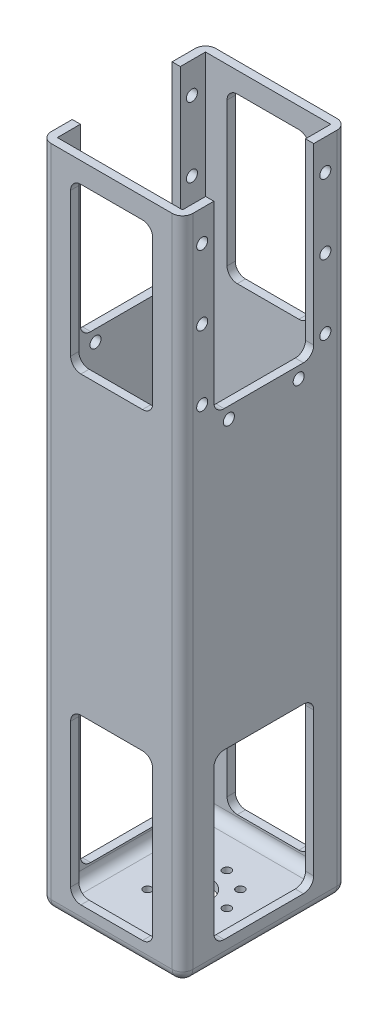
from build123d import *

# Parameters (mm, degrees)
SKETCH2_W           = 34.5
SKETCH2_H           = 40.1
BOSS_EXTRUDE1_DEPTH = 2
SKETCH1_R           = 1
SKETCH1_R_2         = 4.25
CUT_EXTRUDE2_DEPTH  = 27.524799716
SKETCH3_W           = 34.5
SKETCH3_H           = 40.1
SKETCH3_W_2         = 30.5
SKETCH3_H_2         = 36.1
BOSS_EXTRUDE3_DEPTH = 160
SKETCH4_W           = 24.336491673
SKETCH4_H           = 45
SKETCH4_H_2         = 40
CUT_EXTRUDE3_DEPTH  = 167.841998609
SKETCH5_W           = 20
SKETCH5_H           = 40
CUT_EXTRUDE4_DEPTH  = 168.778343358
FILLET1_R           = 2.5
SKETCH7_R           = 1.350000001
CUT_EXTRUDE5_DEPTH  = 167.841998609


with BuildPart() as part:
    # Sketch2 → Boss-Extrude1 (new body)
    with BuildSketch(Plane(origin=(0, 0, 0), x_dir=(1, 0, 0), z_dir=(0, 1, 0))):
        Rectangle(SKETCH2_W, SKETCH2_H)
    extrude(amount=BOSS_EXTRUDE1_DEPTH)

    # Sketch1 → Cut-Extrude2 (cut, through all)
    with BuildSketch(Plane(origin=(0, 0, 0), x_dir=(1, 0, 0), z_dir=(0, 1, 0))):
        with Locations(Location((0, 8, 0), (0, 0, 270))):
            Circle(SKETCH1_R)
        with Locations(Location((5.656854249, 5.656854249, 0), (0, 0, 270))):
            Circle(SKETCH1_R)
        with Locations(Location((8, 0, 0), (0, 0, 270))):
            Circle(SKETCH1_R)
        with Locations(Location((5.656854249, -5.656854249, 0), (0, 0, 270))):
            Circle(SKETCH1_R)
        with Locations(Location((0, -8, 0), (0, 0, 270))):
            Circle(SKETCH1_R)
        with Locations(Location((-5.656854249, -5.656854249, 0), (0, 0, 270))):
            Circle(SKETCH1_R)
        with Locations(Location((-8, 0, 0), (0, 0, 270))):
            Circle(SKETCH1_R)
        with Locations(Location((-5.656854249, 5.656854249, 0), (0, 0, 270))):
            Circle(SKETCH1_R)
        with Locations(Location((0, 0, 0), (0, 0, 270))):
            Circle(SKETCH1_R_2)
    extrude(amount=CUT_EXTRUDE2_DEPTH, mode=Mode.SUBTRACT)

    # Sketch3 → Boss-Extrude3 (add)
    with BuildSketch(Plane(origin=(0, 2, 0), x_dir=(1, 0, 0), z_dir=(0, 1, 0))):
        Rectangle(SKETCH3_W, SKETCH3_H)
        Rectangle(SKETCH3_W_2, SKETCH3_H_2, mode=Mode.SUBTRACT)
    extrude(amount=BOSS_EXTRUDE3_DEPTH)

    # Sketch4 → Cut-Extrude3 (cut, through all)
    with BuildSketch(Plane.ZY.offset(17.25)):
        with Locations((0.249999999, 139.5)):
            Rectangle(SKETCH4_W, SKETCH4_H)
        with Locations((0.249999999, 25)):
            Rectangle(SKETCH4_W, SKETCH4_H_2)
    extrude(amount=-CUT_EXTRUDE3_DEPTH, mode=Mode.SUBTRACT)

    # Sketch5 → Cut-Extrude4 (cut, through all)
    with BuildSketch(Plane.XY.offset(20.05)):
        with Locations((0, 25)):
            Rectangle(SKETCH5_W, SKETCH5_H)
        with Locations((0, 137)):
            Rectangle(SKETCH5_W, SKETCH5_H)
    extrude(amount=-CUT_EXTRUDE4_DEPTH, mode=Mode.SUBTRACT)

    # Fillet1
    fillet1_edges = [part.edges().sort_by_distance(p)[0] for p in [
        (16.25, 5, -11.918245837),
        (16.25, 45, -11.918245837),
        (16.25, 45, 12.418245836),
        (16.25, 5, 12.418245836),
        (-16.25, 5, -11.918245837),
        (-16.25, 45, -11.918245837),
        (-16.25, 45, 12.418245836),
        (-16.25, 5, 12.418245836),
        (10, 45, -19.05),
        (10, 5, -19.05),
        (-10, 5, -19.05),
        (-10, 45, -19.05),
        (10, 45, 19.05),
        (10, 5, 19.05),
        (-10, 5, 19.05),
        (-10, 45, 19.05),
        (10, 157, -19.05),
        (10, 117, -19.05),
        (-10, 117, -19.05),
        (-10, 157, -19.05),
        (10, 157, 19.05),
        (10, 117, 19.05),
        (-10, 117, 19.05),
        (-10, 157, 19.05),
        (0, 0, 20.05),
        (-17.25, 0, 0),
        (0, 0, -20.05),
        (15.25, 2, 0),
        (0, 2, -18.05),
        (-15.25, 2, 0),
        (0, 2, 18.05),
        (17.25, 0, 0),
        (17.25, 81, 20.05),
        (-17.25, 81, 20.05),
        (-17.25, 81, -20.05),
        (17.25, 81, -20.05),
        (16.25, 117, 12.418245836),
        (16.25, 117, -11.918245837),
        (-16.25, 117, 12.418245836),
        (-16.25, 117, -11.918245837),
    ]]
    fillet(fillet1_edges, radius=FILLET1_R)

    # Sketch7 → Cut-Extrude5 (cut, through all)
    with BuildSketch(Plane.ZY.offset(17.25)):
        with Locations((-14.750000001, 154.5)):
            Circle(SKETCH7_R)
        with Locations((-14.750000001, 137.5)):
            Circle(SKETCH7_R)
        with Locations((-14.750000001, 120.5)):
            Circle(SKETCH7_R)
        with Locations((15.249999999, 154.5)):
            Circle(SKETCH7_R)
        with Locations((15.249999999, 137.5)):
            Circle(SKETCH7_R)
        with Locations((15.249999999, 120.5)):
            Circle(SKETCH7_R)
        with Locations((-8.250000001, 114.2)):
            Circle(SKETCH7_R)
        with Locations((8.749999999, 114.2)):
            Circle(SKETCH7_R)
    extrude(amount=-CUT_EXTRUDE5_DEPTH, mode=Mode.SUBTRACT)


solid = part.part
